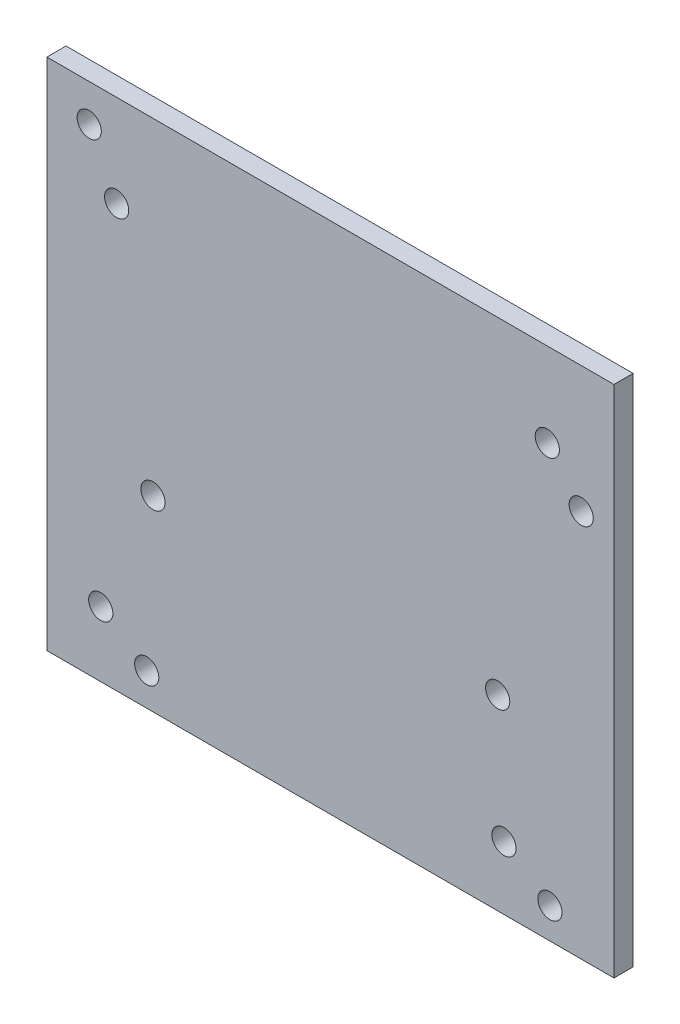
from build123d import *

# Parameters (mm, degrees)
SKETCH1_W           = 188.029038606
SKETCH1_H           = 170.442430471
SKETCH1_R           = 4.0127
SKETCH1_R_2         = 4.0132
BOSS_EXTRUDE1_DEPTH = 6.35


with BuildPart() as part:
    # Sketch1 → Boss-Extrude1 (new body)
    with BuildSketch(Plane.XY):
        with Locations((-613.822320535, 293.124480822)):
            Rectangle(SKETCH1_W, SKETCH1_H)
        with Locations((-674.736409601, 218.698265586)):
            Circle(SKETCH1_R, mode=Mode.SUBTRACT)
        with Locations((-689.976409601, 229.493265586)):
            Circle(SKETCH1_R, mode=Mode.SUBTRACT)
        with Locations((-693.801112975, 366.025192331)):
            Circle(SKETCH1_R, mode=Mode.SUBTRACT)
        with Locations((-684.704749339, 347.843833922)):
            Circle(SKETCH1_R, mode=Mode.SUBTRACT)
        with Locations((-541.912606261, 350.497238651)):
            Circle(SKETCH1_R, mode=Mode.SUBTRACT)
        with Locations((-530.669548253, 336.491038359)):
            Circle(SKETCH1_R, mode=Mode.SUBTRACT)
        with Locations((-541.046317861, 218.063265586)):
            Circle(SKETCH1_R, mode=Mode.SUBTRACT)
        with Locations((-556.286317861, 228.858265586)):
            Circle(SKETCH1_R, mode=Mode.SUBTRACT)
        with Locations((-558.361573731, 269.972580351)):
            Circle(SKETCH1_R_2, mode=Mode.SUBTRACT)
        with Locations((-672.661153731, 269.972580351)):
            Circle(SKETCH1_R_2, mode=Mode.SUBTRACT)
    extrude(amount=BOSS_EXTRUDE1_DEPTH)


solid = part.part
